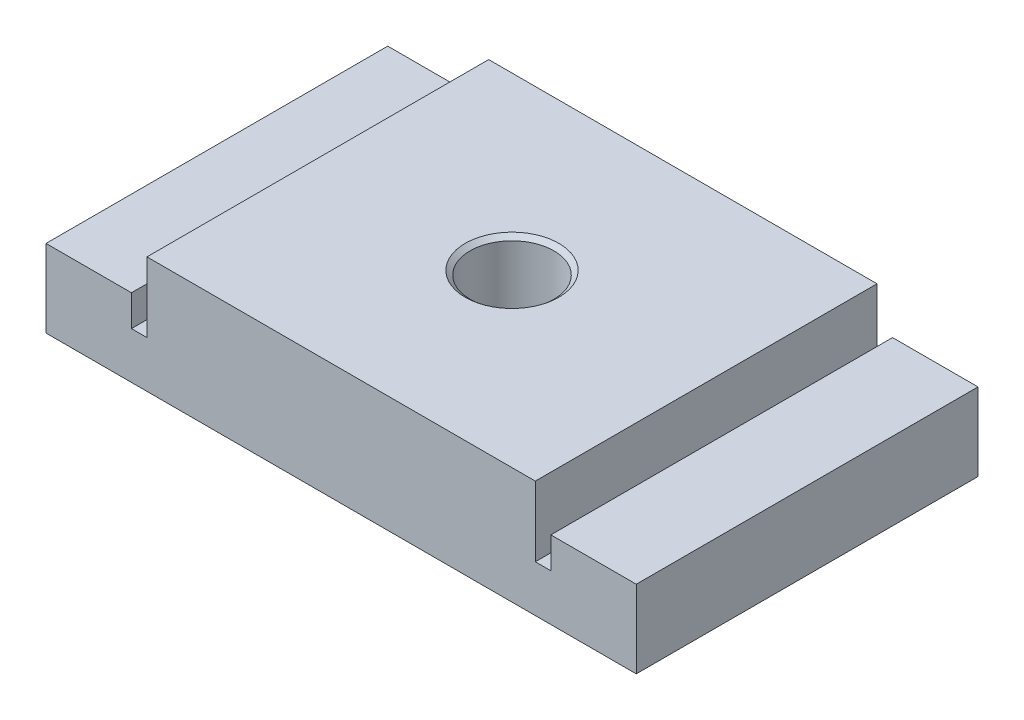
from build123d import *

# Parameters (mm, degrees)
BOSS_EXTRUDE1_DEPTH               = 22
M12X1_25_TAPPED_HOLE1_D           = 10.8
M12X1_25_TAPPED_HOLE1_CSINK_D     = 12.05
M12X1_25_TAPPED_HOLE1_CSINK_ANGLE = 100


with BuildPart() as part:
    # Sketch1 → Boss-Extrude1 (new, symmetric)
    with BuildSketch(Plane.XY):
        Polygon((-38, 0), (-38, 10), (-27, 10), (-27, 6), (-25, 6), (-25, 15), (25, 15), (25, 6), (27, 6), (27, 10), (38, 10), (38, 0), align=None)
    extrude(amount=BOSS_EXTRUDE1_DEPTH, both=True)

    # M12x1.25 Tapped Hole1 (through all)
    with Locations(Plane(origin=(0, 15, 0), x_dir=(1, 0, 0), z_dir=(0, 1, 0))):
        with Locations((0, 0)):
            CounterSinkHole(M12X1_25_TAPPED_HOLE1_D / 2, M12X1_25_TAPPED_HOLE1_CSINK_D / 2, counter_sink_angle=M12X1_25_TAPPED_HOLE1_CSINK_ANGLE)


solid = part.part
